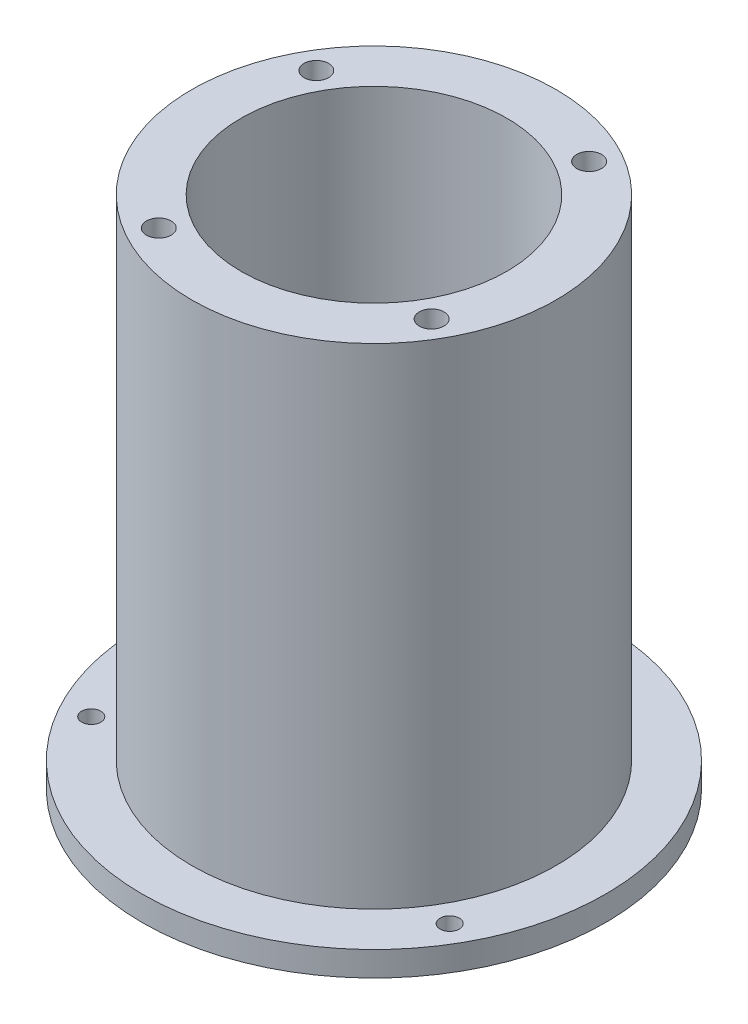
from build123d import *

# Parameters (mm, degrees)
SKETCH1_R           = 37.5
SKETCH1_R_2         = 21.5
BOSS_EXTRUDE1_DEPTH = 4
SKETCH2_R           = 29.5
SKETCH2_R_2         = 21.5
BOSS_EXTRUDE2_DEPTH = 79.3
SKETCH3_R           = 1.55
CUT_EXTRUDE1_DEPTH  = 96.399109011
CIRPATTERN1_COUNT   = 3
SKETCH4_R           = 2
CUT_EXTRUDE2_DEPTH  = 6
CIRPATTERN2_COUNT   = 4


with BuildPart() as part:
    # Sketch1 → Boss-Extrude1 (new body)
    with BuildSketch(Plane(origin=(0, 0, 0), x_dir=(1, 0, 0), z_dir=(0, 1, 0))):
        with Locations(Location((0, 0, 0), (0, 0, 270))):
            Circle(SKETCH1_R)
        with Locations(Location((0, 0, 0), (0, 0, 270))):
            Circle(SKETCH1_R_2, mode=Mode.SUBTRACT)
    extrude(amount=BOSS_EXTRUDE1_DEPTH)

    # Sketch2 → Boss-Extrude2 (add)
    with BuildSketch(Plane(origin=(0, 4, 0), x_dir=(1, 0, 0), z_dir=(0, 1, 0))):
        with Locations(Location((0, 0, 0), (0, 0, 270))):
            Circle(SKETCH2_R)
        with Locations(Location((0, 0, 0), (0, 0, 270))):
            Circle(SKETCH2_R_2, mode=Mode.SUBTRACT)
    extrude(amount=BOSS_EXTRUDE2_DEPTH)

    # Sketch3 → Cut-Extrude1 (cut, through all)
    with BuildSketch(Plane(origin=(0, 4, 0), x_dir=(1, 0, 0), z_dir=(0, 1, 0))):
        with Locations(Location((0, 33.5, 0), (0, 0, 270))):
            Circle(SKETCH3_R)
    cut_extrude1 = extrude(amount=-CUT_EXTRUDE1_DEPTH, mode=Mode.SUBTRACT)

    # CirPattern1: Cut-Extrude1 ×3 about axis
    cirpattern1_axis = Axis((0, 0, 0), (0, 1, 0))
    for i in range(1, CIRPATTERN1_COUNT):
        add(cut_extrude1.rotate(cirpattern1_axis, i * 360 / CIRPATTERN1_COUNT), mode=Mode.SUBTRACT)

    # Sketch4 → Cut-Extrude2 (cut)
    with BuildSketch(Plane(origin=(0, 83.3, 0), x_dir=(1, 0, 0), z_dir=(0, 1, 0))):
        with Locations(Location((-22.083647797, 12.75, 0), (0, 0, 270))):
            Circle(SKETCH4_R)
    cut_extrude2 = extrude(amount=-CUT_EXTRUDE2_DEPTH, mode=Mode.SUBTRACT)

    # CirPattern2: Cut-Extrude2 ×4 about axis
    cirpattern2_axis = Axis((0, 0, 0), (0, 1, 0))
    for i in range(1, CIRPATTERN2_COUNT):
        add(cut_extrude2.rotate(cirpattern2_axis, i * 360 / CIRPATTERN2_COUNT), mode=Mode.SUBTRACT)


solid = part.part
